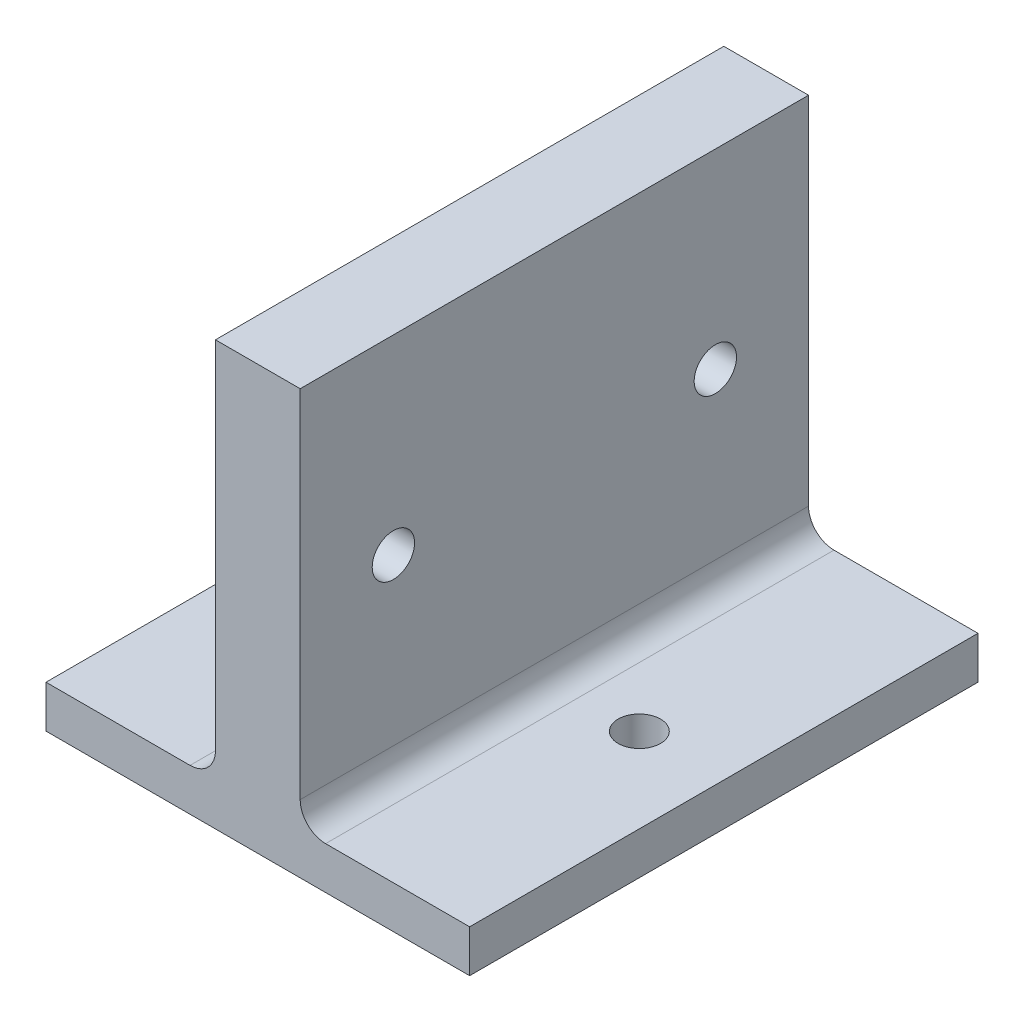
from build123d import *

# Parameters (mm, degrees)
SKETCH1_W           = 50
SKETCH1_H           = 60
BOSS_EXTRUDE1_DEPTH = 5
SKETCH2_W           = 10
SKETCH2_H           = 60
BOSS_EXTRUDE2_DEPTH = 45
SKETCH3_R           = 2.5
CUT_EXTRUDE1_DEPTH  = 60.581876439
CUT_EXTRUDE2_REACH  = 67.574
SKETCH5_R           = 2.5
FILLET1_R           = 3


with BuildPart() as part:
    # Sketch1 → Boss-Extrude1 (new body)
    with BuildSketch(Plane(origin=(0, 0, 0), x_dir=(1, 0, 0), z_dir=(0, 1, 0))):
        Rectangle(SKETCH1_W, SKETCH1_H)
    extrude(amount=BOSS_EXTRUDE1_DEPTH)

    # Sketch2 → Boss-Extrude2 (add)
    with BuildSketch(Plane(origin=(0, 5, 0), x_dir=(1, 0, 0), z_dir=(0, 1, 0))):
        Rectangle(SKETCH2_W, SKETCH2_H)
    extrude(amount=BOSS_EXTRUDE2_DEPTH)

    # Sketch3 → Cut-Extrude1 (cut, through all)
    with BuildSketch(Plane(origin=(0, 5, 0), x_dir=(1, 0, 0), z_dir=(0, 1, 0))):
        with Locations(Location((-15.028328695, 0, 0), (0, 0, 270))):
            Circle(SKETCH3_R)
        with Locations(Location((15.028328695, 0, 0), (0, 0, 270))):
            Circle(SKETCH3_R)
    extrude(amount=-CUT_EXTRUDE1_DEPTH, mode=Mode.SUBTRACT)

    # Sketch5 → Cut-Extrude2 (cut, up to next)
    with BuildSketch(Plane.ZY.offset(5), mode=Mode.PRIVATE) as cut_extrude2_sk1:
        with Locations((-19, 27.5)):
            Circle(SKETCH5_R)
    cut_extrude2_tool1 = extrude(cut_extrude2_sk1.sketch, amount=-CUT_EXTRUDE2_REACH, mode=Mode.PRIVATE) & part.part
    # Sketch5 → Cut-Extrude2 (cut, up to next)
    with BuildSketch(Plane.ZY.offset(5), mode=Mode.PRIVATE) as cut_extrude2_sk2:
        with Locations((19, 27.5)):
            Circle(SKETCH5_R)
    cut_extrude2_tool2 = extrude(cut_extrude2_sk2.sketch, amount=-CUT_EXTRUDE2_REACH, mode=Mode.PRIVATE) & part.part
    add(cut_extrude2_tool1.solids().sort_by_distance((-5, 27.5, -19))[0], mode=Mode.SUBTRACT)
    add(cut_extrude2_tool2.solids().sort_by_distance((-5, 27.5, 19))[0], mode=Mode.SUBTRACT)

    # Fillet1
    fillet1_edges = [part.edges().sort_by_distance(p)[0] for p in [
        (5, 5, 0),
        (-5, 5, 0),
    ]]
    fillet(fillet1_edges, radius=FILLET1_R)


solid = part.part
